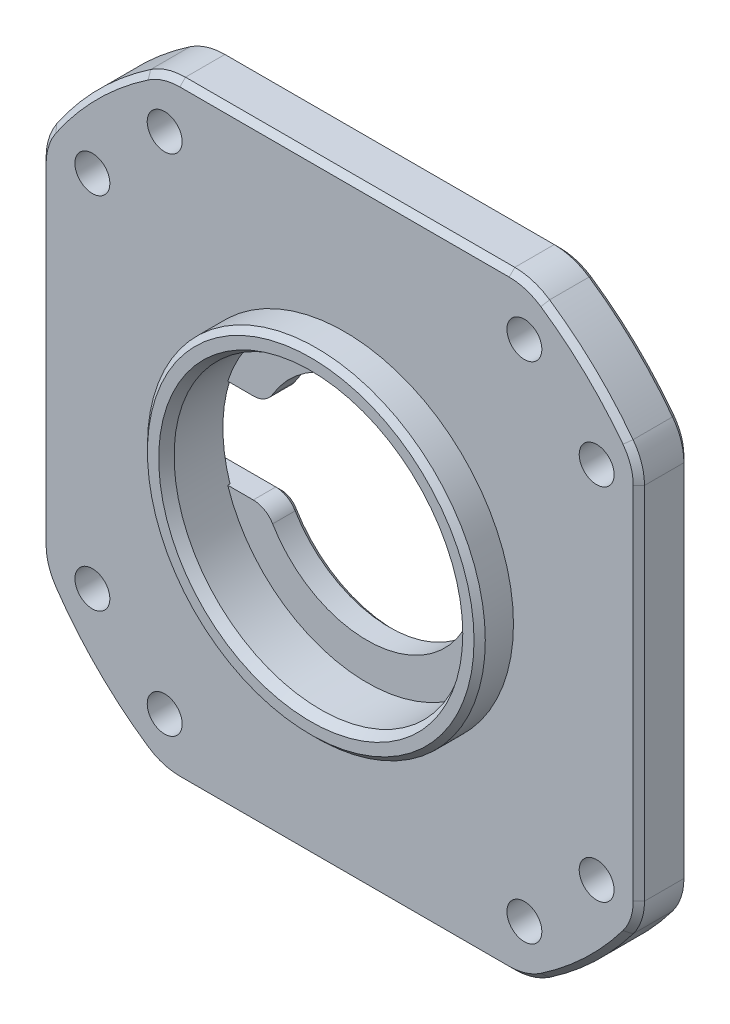
from build123d import *

# Parameters (mm, degrees)
SKETCH_2_W               = 51
SKETCH_2_H               = 51
SKETCH_2_R               = 1.55
EXTRUDE_1_DEPTH          = 4.5
CUT_EXTRUDE_1_DEPTH      = 5
FILLET_1_R               = 4
SKETCH_5_R               = 13
CUT_EXTRUDE_2_DEPTH      = 2
CUT_EXTRUDE_3_DEPTH      = 37.14899722
CUT_EXTRUDE_3_DEPTH_BACK = 37.14899722
SKETCH_6_R               = 9.75
CUT_EXTRUDE_4_DEPTH      = 37.342124319
CUT_EXTRUDE_4_DEPTH_BACK = 2.3
SKETCH_8_W               = 28
SKETCH_8_H               = 8
EXTRUDE_START            = -4.5
EXTRUDE_2_DEPTH          = 4.5
CUT_EXTRUDE_7_DEPTH      = 39.448016854
CUT_EXTRUDE_7_DEPTH_BACK = 2.3
SKETCH_11_W              = 1.5
SKETCH_11_H              = 8
FILLET_3_R               = 1
FILLET_4_R               = 5
EXTRUDE_START_2          = 3
SKETCH_12_R              = 15
SKETCH_12_R_2            = 13
EXTRUDE_3_DEPTH          = 3
CUT_EXTRUDE_START        = -0.2
CUT_EXTRUDE_8_DEPTH      = 0.2
FILLET_5_R               = 2
CHAMFER_1_SIZE           = 0.5
CHAMFER_2_SIZE           = 0.5
CHAMFER_2_SIZE2          = 0.866025404


with BuildPart() as part:
    # 草图2 → 凸台-拉伸1 (new body)
    with BuildSketch(Plane.XY):
        Rectangle(SKETCH_2_W, SKETCH_2_H)
        with Locations((-22.388176755, 15.969331282)):
            Circle(SKETCH_2_R, mode=Mode.SUBTRACT)
        with Locations((-15.969331282, 22.388176755)):
            Circle(SKETCH_2_R, mode=Mode.SUBTRACT)
        with Locations(Location((15.969331282, 22.388176755, 0), (0, 0, 180))):
            Circle(SKETCH_2_R, mode=Mode.SUBTRACT)
        with Locations(Location((22.388176755, 15.969331282, 0), (0, 0, 180))):
            Circle(SKETCH_2_R, mode=Mode.SUBTRACT)
        with Locations((22.388176755, -15.969331282)):
            Circle(SKETCH_2_R, mode=Mode.SUBTRACT)
        with Locations((15.969331282, -22.388176755)):
            Circle(SKETCH_2_R, mode=Mode.SUBTRACT)
        with Locations(Location((-15.969331282, -22.388176755, 0), (0, 0, 180))):
            Circle(SKETCH_2_R, mode=Mode.SUBTRACT)
        with Locations(Location((-22.388176755, -15.969331282, 0), (0, 0, 180))):
            Circle(SKETCH_2_R, mode=Mode.SUBTRACT)
    extrude(amount=EXTRUDE_1_DEPTH)

    # 草图4 → 切除-拉伸1 (cut)
    with BuildSketch(Plane.XY.offset(4.5)):
        with BuildLine():
            Line((-25.5, -15.803480629), (-25.5, -25.5))
            Line((-25.5, -25.5), (-15.803480629, -25.5))
            ThreePointArc((-15.803480629, -25.5), (-21.213203436, -21.213203436), (-25.5, -15.803480629))
        make_face()
        with BuildLine():
            Line((15.803480629, -25.5), (25.5, -25.5))
            Line((25.5, -25.5), (25.5, -15.803480629))
            ThreePointArc((25.5, -15.803480629), (21.213203436, -21.213203436), (15.803480629, -25.5))
        make_face()
        with BuildLine():
            Line((25.5, 15.803480629), (25.5, 25.5))
            Line((25.5, 25.5), (15.803480629, 25.5))
            ThreePointArc((15.803480629, 25.5), (21.213203436, 21.213203436), (25.5, 15.803480629))
        make_face()
        with BuildLine():
            Line((-15.803480629, 25.5), (-25.5, 25.5))
            Line((-25.5, 25.5), (-25.5, 15.803480629))
            ThreePointArc((-25.5, 15.803480629), (-21.213203436, 21.213203436), (-15.803480629, 25.5))
        make_face()
    extrude(amount=-CUT_EXTRUDE_1_DEPTH, mode=Mode.SUBTRACT)

    # 圆角1
    fillet_1_edges = [part.edges().sort_by_distance(p)[0] for p in [
        (-15.803480629, -25.5, 2.25),
        (15.803480629, -25.5, 2.25),
        (-25.5, 15.803480629, 2.25),
        (15.803480629, 25.5, 2.25),
        (-15.803480629, 25.5, 2.25),
        (25.5, 15.803480629, 2.25),
        (25.5, -15.803480629, 2.25),
        (-25.5, -15.803480629, 2.25),
    ]]
    fillet(fillet_1_edges, radius=FILLET_1_R)

    # 草图5 → 切除-拉伸2 (cut)
    with BuildSketch(Plane.XY.offset(4.5)):
        Circle(SKETCH_5_R)
    extrude(amount=-CUT_EXTRUDE_2_DEPTH, mode=Mode.SUBTRACT)

    # 草图6 → 切除-拉伸3 (cut, two sides: drawn at the far end of the back side and taken through both)
    with BuildSketch(Plane.XY.offset(2.5).offset(-CUT_EXTRUDE_3_DEPTH_BACK)):
        Circle(SKETCH_6_R)
    extrude(amount=CUT_EXTRUDE_3_DEPTH + CUT_EXTRUDE_3_DEPTH_BACK, mode=Mode.SUBTRACT)

    # 草图8 → 切除-拉伸4 (cut, two sides: drawn at the far end of the back side and taken through both)
    with BuildSketch(Plane(origin=(0, 0, 0), x_dir=(-1, 0, 0), z_dir=(0, 0, -1)).offset(-CUT_EXTRUDE_4_DEPTH_BACK)):
        with Locations((22.891709622, 0)):
            Rectangle(SKETCH_8_W, SKETCH_8_H)
    extrude(amount=CUT_EXTRUDE_4_DEPTH + CUT_EXTRUDE_4_DEPTH_BACK, mode=Mode.SUBTRACT)

    # 草图9 → 凸台-拉伸2 (add)
    with BuildSketch(Plane(origin=(0, 0, 0), x_dir=(-1, 0, 0), z_dir=(0, 0, -1)).offset(EXTRUDE_START)):
        with BuildLine():
            ThreePointArc((-26.048076923, 17.712924338), (-26.09265794, 17.646326518), (-26.136263836, 17.579086183))
            Line((-26.136263836, 17.579086183), (-26.136263836, -17.579086183))
            ThreePointArc((-26.136263836, -17.579086183), (-26.09265794, -17.646326518), (-26.048076923, -17.712924338))
            ThreePointArc((-26.048076923, -17.712924338), (-22.273863607, -22.273863607), (-17.712924338, -26.048076923))
            ThreePointArc((-17.712924338, -26.048076923), (-16.238149632, -26.756635001), (-14.620191517, -27))
            Line((-14.620191517, -27), (14.620191517, -27))
            ThreePointArc((14.620191517, -27), (16.238149632, -26.756635001), (17.712924338, -26.048076923))
            ThreePointArc((17.712924338, -26.048076923), (22.273863607, -22.273863607), (26.048076923, -17.712924338))
            ThreePointArc((26.048076923, -17.712924338), (26.756635001, -16.238149632), (27, -14.620191517))
            Line((27, -14.620191517), (27, 14.620191517))
            ThreePointArc((27, 14.620191517), (26.756635001, 16.238149632), (26.048076923, 17.712924338))
            ThreePointArc((26.048076923, 17.712924338), (22.273863607, 22.273863607), (17.712924338, 26.048076923))
            ThreePointArc((17.712924338, 26.048076923), (16.238149632, 26.756635001), (14.620191517, 27))
            Line((14.620191517, 27), (-14.620191517, 27))
            ThreePointArc((-14.620191517, 27), (-16.238149632, 26.756635001), (-17.712924338, 26.048076923))
            ThreePointArc((-17.712924338, 26.048076923), (-22.273863607, 22.273863607), (-26.048076923, 17.712924338))
        make_face()
        with BuildLine():
            Line((25.5, 14.620191517), (25.5, 5))
            Line((25.5, 5), (25.5, 4))
            Line((25.5, 4), (25.5, -4))
            Line((25.5, -4), (25.5, -14.620191517))
            ThreePointArc((25.5, -14.620191517), (25.323007274, -15.796888328), (24.807692308, -16.869451751))
            ThreePointArc((24.807692308, -16.869451751), (21.213203436, -21.213203436), (16.869451751, -24.807692308))
            ThreePointArc((16.869451751, -24.807692308), (15.796888328, -25.323007274), (14.620191517, -25.5))
            Line((14.620191517, -25.5), (-14.620191517, -25.5))
            ThreePointArc((-14.620191517, -25.5), (-15.796888328, -25.323007274), (-16.869451751, -24.807692308))
            ThreePointArc((-16.869451751, -24.807692308), (-21.213203436, -21.213203436), (-24.807692308, -16.869451751))
            ThreePointArc((-24.807692308, -16.869451751), (-25.323007274, -15.796888328), (-25.5, -14.620191517))
            Line((-25.5, -14.620191517), (-25.5, 14.620191517))
            ThreePointArc((-25.5, 14.620191517), (-25.323007274, 15.796888328), (-24.807692308, 16.869451751))
            ThreePointArc((-24.807692308, 16.869451751), (-21.213203436, 21.213203436), (-16.869451751, 24.807692308))
            ThreePointArc((-16.869451751, 24.807692308), (-15.796888328, 25.323007274), (-14.620191517, 25.5))
            Line((-14.620191517, 25.5), (14.620191517, 25.5))
            ThreePointArc((14.620191517, 25.5), (15.796888328, 25.323007274), (16.869451751, 24.807692308))
            ThreePointArc((16.869451751, 24.807692308), (21.213203436, 21.213203436), (24.807692308, 16.869451751))
            ThreePointArc((24.807692308, 16.869451751), (25.323007274, 15.796888328), (25.5, 14.620191517))
        make_face(mode=Mode.SUBTRACT)
    extrude(amount=EXTRUDE_2_DEPTH)

    # 草图11 → 切除-拉伸7 (cut, two sides: drawn at the far end of the back side and taken through both)
    with BuildSketch(Plane(origin=(0, 0, 0), x_dir=(-1, 0, 0), z_dir=(0, 0, -1)).offset(-CUT_EXTRUDE_7_DEPTH_BACK)):
        with Locations((26.25, 0)):
            Rectangle(SKETCH_11_W, SKETCH_11_H)
    extrude(amount=CUT_EXTRUDE_7_DEPTH + CUT_EXTRUDE_7_DEPTH_BACK, mode=Mode.SUBTRACT)

    # 圆角3
    fillet_3_edges = [part.edges().sort_by_distance(p)[0] for p in [
        (-27, 4, 1.15),
        (-27, -4, 1.15),
        (-27, 0, 2.3),
    ]]
    fillet(fillet_3_edges, radius=FILLET_3_R)

    # 圆角4
    fillet_4_edges = [part.edges().sort_by_distance(p)[0] for p in [
        (26.136263836, 17.579086183, 2.25),
        (26.136263836, -17.579086183, 2.25),
    ]]
    fillet(fillet_4_edges, radius=FILLET_4_R)

    # 草图12 → 凸台-拉伸3 (add)
    with BuildSketch(Plane.XY.offset(4.5).offset(EXTRUDE_START_2)):
        Circle(SKETCH_12_R)
        Circle(SKETCH_12_R_2, mode=Mode.SUBTRACT)
    extrude(amount=-EXTRUDE_3_DEPTH)

    # 草图13 → 切除-拉伸8 (cut)
    with BuildSketch(Plane(origin=(0, 0, 2.3), x_dir=(-1, 0, 0), z_dir=(0, 0, -1)).offset(CUT_EXTRUDE_START)):
        with BuildLine():
            Line((8.891709622, 4), (12.369316877, 4))
            ThreePointArc((12.369316877, 4), (13, 0), (12.369316877, -4))
            Line((12.369316877, -4), (8.891709622, -4))
            ThreePointArc((8.891709622, -4), (9.75, 0), (8.891709622, 4))
        make_face()
    extrude(amount=CUT_EXTRUDE_8_DEPTH, mode=Mode.SUBTRACT)

    # 圆角5
    fillet_5_edges = [part.edges().sort_by_distance(p)[0] for p in [
        (-8.891709622, -4, 1.25),
        (-8.891709622, 4, 1.25),
    ]]
    fillet(fillet_5_edges, radius=FILLET_5_R)

    # 倒角1
    chamfer_1_edges = [part.edges().sort_by_distance(p)[0] for p in [
        (21.706505209, 22.827124909, 0),
        (16.238149632, -26.756635001, 0),
        (0, -27, 0),
        (-16.238149632, -26.756635001, 0),
        (-22.273863607, -22.273863607, 0),
        (-26.756635001, -16.238149632, 0),
        (-27, -9.810095759, 0),
        (-26.756635001, 16.238149632, 0),
        (-22.273863607, 22.273863607, 0),
        (-16.238149632, 26.756635001, 0),
        (0, 27, 0),
        (16.238149632, 26.756635001, 0),
        (16.238149632, -26.756635001, 4.5),
        (0, -27, 4.5),
        (-16.238149632, -26.756635001, 4.5),
        (-22.273863607, -22.273863607, 4.5),
        (-26.756635001, -16.238149632, 4.5),
        (-27, 0, 4.5),
        (-26.756635001, 16.238149632, 4.5),
        (-22.273863607, 22.273863607, 4.5),
        (-16.238149632, 26.756635001, 4.5),
        (0, 27, 4.5),
        (16.238149632, 26.756635001, 4.5),
        (21.706505209, 22.827124909, 4.5),
        (-27, 9.810095759, 0),
        (-18.051299338, 4, 0),
        (-26.707106781, 4.292893219, 0),
        (-26.707106781, -4.292893219, 0),
        (26.136263836, 0, 0),
        (21.706505209, -22.827124909, 0),
        (25.876510219, -17.575246148, 0),
        (25.876510219, 17.575246148, 0),
        (26.136263836, 0, 4.5),
        (21.706505209, -22.827124909, 4.5),
        (25.876510219, -17.575246148, 4.5),
        (25.876510219, 17.575246148, 4.5),
        (-15, 0, 7.5),
        (-18.051299338, -4, 0),
        (9.75, 0, 0),
        (-9.11329417, 4.26181802, 0),
        (-9.11329417, -4.26181802, 0),
    ]]
    chamfer(chamfer_1_edges, length=CHAMFER_1_SIZE)

    # 倒角2
    chamfer_2_edges = [part.edges().sort_by_distance(p)[0] for p in [
        (-13, 0, 7.5),
    ]]
    chamfer_2_side = [part.faces().sort_by_distance(p)[0] for p in [
        (-14.089878067, 0, 7.5),
    ]]
    chamfer(chamfer_2_edges, length=CHAMFER_2_SIZE, length2=CHAMFER_2_SIZE2, reference=chamfer_2_side[0])


solid = part.part
